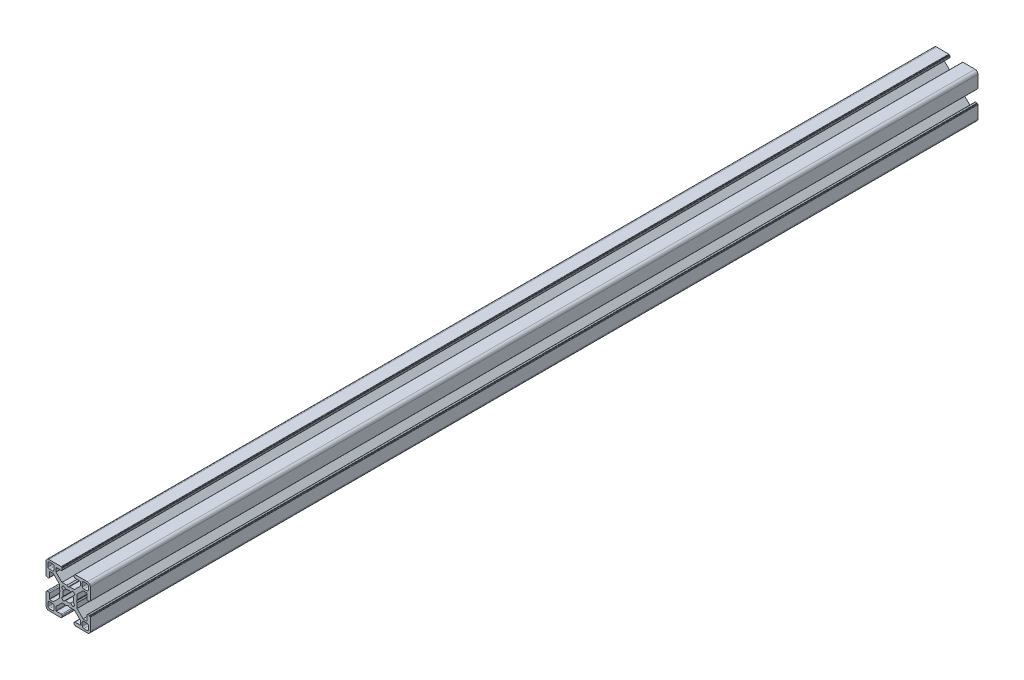
from build123d import *

# Parameters (mm, degrees)
BOSS_EXTRUDE1_DEPTH = 600


with BuildPart() as part:
    # Sketch1 → Boss-Extrude1 (new body)
    with BuildSketch(Plane.XY.offset(25)):
        with BuildLine():
            Line((-4.05, 13.399999434), (-4.05, 14.299999626))
            ThreePointArc((-4.05, 14.299999626), (-4.108578753, 14.441421247), (-4.250000374, 14.5))
            Line((-4.250000374, 14.5), (-4.350000144, 14.5))
            ThreePointArc((-4.350000144, 14.5), (-4.49142109, 14.558578474), (-4.549999564, 14.69999942))
            Line((-4.549999564, 14.69999942), (-4.549999564, 14.799999619))
            ThreePointArc((-4.549999564, 14.799999619), (-4.60857832, 14.941421245), (-4.749999945, 15))
            Line((-4.749999945, 15), (-13.000000346, 15))
            ThreePointArc((-13.000000346, 15), (-14.414213664, 14.414213664), (-15, 13.000000346))
            Line((-15, 13.000000346), (-15, 4.749999521))
            ThreePointArc((-15, 4.749999521), (-14.941421273, 4.608577964), (-14.799999716, 4.549999237))
            Line((-14.799999716, 4.549999237), (-14.700000611, 4.549999237))
            ThreePointArc((-14.700000611, 4.549999237), (-14.558579054, 4.49142051), (-14.500000327, 4.349998953))
            Line((-14.500000327, 4.349998953), (-14.500000327, 4.249999521))
            ThreePointArc((-14.500000327, 4.249999521), (-14.4414216, 4.108577964), (-14.300000043, 4.049999237))
            Line((-14.300000043, 4.049999237), (-13.39999994, 4.049999237))
            ThreePointArc((-13.39999994, 4.049999237), (-12.975735606, 4.225735278), (-12.799999564, 4.649999613))
            Line((-12.799999564, 4.649999613), (-12.799999564, 8.049999716))
            ThreePointArc((-12.799999564, 8.049999716), (-12.741420837, 8.191421273), (-12.59999928, 8.25))
            Line((-12.59999928, 8.25), (-10.049999564, 8.25))
            Line((-10.049999564, 8.25), (-6.00446543, 4.204465866))
            Line((-6.00446543, 4.204465866), (-6.00446543, 0.899999619))
            Line((-6.00446543, 0.899999619), (-5.484852164, 0))
            Line((-5.484852164, 0), (-6.00446543, -0.899999619))
            Line((-6.00446543, -0.899999619), (-6.00446543, -4.204465866))
            Line((-6.00446543, -4.204465866), (-10.049999564, -8.25))
            Line((-10.049999564, -8.25), (-12.59999928, -8.25))
            ThreePointArc((-12.59999928, -8.25), (-12.741420837, -8.191421273), (-12.799999564, -8.049999716))
            Line((-12.799999564, -8.049999716), (-12.799999564, -4.649999613))
            ThreePointArc((-12.799999564, -4.649999613), (-12.975735606, -4.225735278), (-13.39999994, -4.049999237))
            Line((-13.39999994, -4.049999237), (-14.300000043, -4.049999237))
            ThreePointArc((-14.300000043, -4.049999237), (-14.4414216, -4.108577964), (-14.500000327, -4.249999521))
            Line((-14.500000327, -4.249999521), (-14.500000327, -4.349998953))
            ThreePointArc((-14.500000327, -4.349998953), (-14.558579054, -4.49142051), (-14.700000611, -4.549999237))
            Line((-14.700000611, -4.549999237), (-14.799999716, -4.549999237))
            ThreePointArc((-14.799999716, -4.549999237), (-14.941421273, -4.608577964), (-15, -4.749999521))
            Line((-15, -4.749999521), (-15, -13.000000346))
            ThreePointArc((-15, -13.000000346), (-14.414213664, -14.414213664), (-13.000000346, -15))
            Line((-13.000000346, -15), (-4.749999945, -15))
            ThreePointArc((-4.749999945, -15), (-4.60857832, -14.941421245), (-4.549999564, -14.799999619))
            Line((-4.549999564, -14.799999619), (-4.549999564, -14.69999942))
            ThreePointArc((-4.549999564, -14.69999942), (-4.49142109, -14.558578474), (-4.350000144, -14.5))
            Line((-4.350000144, -14.5), (-4.250000374, -14.5))
            ThreePointArc((-4.250000374, -14.5), (-4.108578753, -14.441421247), (-4.05, -14.299999626))
            Line((-4.05, -14.299999626), (-4.05, -13.399999434))
            ThreePointArc((-4.05, -13.399999434), (-4.225735989, -12.975735226), (-4.650000197, -12.799999237))
            Line((-4.650000197, -12.799999237), (-8.049999924, -12.799999237))
            ThreePointArc((-8.049999924, -12.799999237), (-8.191421565, -12.741420475), (-8.250000327, -12.599998834))
            Line((-8.250000327, -12.599998834), (-8.250000327, -10.049999237))
            Line((-8.250000327, -10.049999237), (-4.204466193, -6))
            Line((-4.204466193, -6), (-0.899999946, -6))
            Line((-0.899999946, -6), (0, -5.484851837))
            Line((0, -5.484851837), (0.899999946, -6))
            Line((0.899999946, -6), (4.204466193, -6))
            Line((4.204466193, -6), (8.250000327, -10.049999237))
            Line((8.250000327, -10.049999237), (8.250000327, -12.599998834))
            ThreePointArc((8.250000327, -12.599998834), (8.191421565, -12.741420475), (8.049999924, -12.799999237))
            Line((8.049999924, -12.799999237), (4.650000197, -12.799999237))
            ThreePointArc((4.650000197, -12.799999237), (4.225735989, -12.975735226), (4.05, -13.399999434))
            Line((4.05, -13.399999434), (4.05, -14.299999626))
            ThreePointArc((4.05, -14.299999626), (4.108578753, -14.441421247), (4.250000374, -14.5))
            Line((4.250000374, -14.5), (4.350000144, -14.5))
            ThreePointArc((4.350000144, -14.5), (4.49142109, -14.558578474), (4.549999564, -14.69999942))
            Line((4.549999564, -14.69999942), (4.549999564, -14.799999619))
            ThreePointArc((4.549999564, -14.799999619), (4.60857832, -14.941421245), (4.749999945, -15))
            Line((4.749999945, -15), (13.000000346, -15))
            ThreePointArc((13.000000346, -15), (14.414213664, -14.414213664), (15, -13.000000346))
            Line((15, -13.000000346), (15, -4.749999521))
            ThreePointArc((15, -4.749999521), (14.941421273, -4.608577964), (14.799999716, -4.549999237))
            Line((14.799999716, -4.549999237), (14.700000611, -4.549999237))
            ThreePointArc((14.700000611, -4.549999237), (14.558579054, -4.49142051), (14.500000327, -4.349998953))
            Line((14.500000327, -4.349998953), (14.500000327, -4.249999521))
            ThreePointArc((14.500000327, -4.249999521), (14.4414216, -4.108577964), (14.300000043, -4.049999237))
            Line((14.300000043, -4.049999237), (13.39999994, -4.049999237))
            ThreePointArc((13.39999994, -4.049999237), (12.975735606, -4.225735278), (12.799999564, -4.649999613))
            Line((12.799999564, -4.649999613), (12.799999564, -8.049999716))
            ThreePointArc((12.799999564, -8.049999716), (12.741420837, -8.191421273), (12.59999928, -8.25))
            Line((12.59999928, -8.25), (10.049999564, -8.25))
            Line((10.049999564, -8.25), (6.00446543, -4.204465866))
            Line((6.00446543, -4.204465866), (6.00446543, -0.899999619))
            Line((6.00446543, -0.899999619), (5.484852164, 0))
            Line((5.484852164, 0), (6.00446543, 0.899999619))
            Line((6.00446543, 0.899999619), (6.00446543, 4.204465866))
            Line((6.00446543, 4.204465866), (10.049999564, 8.25))
            Line((10.049999564, 8.25), (12.59999928, 8.25))
            ThreePointArc((12.59999928, 8.25), (12.741420837, 8.191421273), (12.799999564, 8.049999716))
            Line((12.799999564, 8.049999716), (12.799999564, 4.649999613))
            ThreePointArc((12.799999564, 4.649999613), (12.975735606, 4.225735278), (13.39999994, 4.049999237))
            Line((13.39999994, 4.049999237), (14.300000043, 4.049999237))
            ThreePointArc((14.300000043, 4.049999237), (14.4414216, 4.108577964), (14.500000327, 4.249999521))
            Line((14.500000327, 4.249999521), (14.500000327, 4.349998953))
            ThreePointArc((14.500000327, 4.349998953), (14.558579054, 4.49142051), (14.700000611, 4.549999237))
            Line((14.700000611, 4.549999237), (14.799999716, 4.549999237))
            ThreePointArc((14.799999716, 4.549999237), (14.941421273, 4.608577964), (15, 4.749999521))
            Line((15, 4.749999521), (15, 13.000000346))
            ThreePointArc((15, 13.000000346), (14.414213664, 14.414213664), (13.000000346, 15))
            Line((13.000000346, 15), (4.749999945, 15))
            ThreePointArc((4.749999945, 15), (4.60857832, 14.941421245), (4.549999564, 14.799999619))
            Line((4.549999564, 14.799999619), (4.549999564, 14.69999942))
            ThreePointArc((4.549999564, 14.69999942), (4.49142109, 14.558578474), (4.350000144, 14.5))
            Line((4.350000144, 14.5), (4.250000374, 14.5))
            ThreePointArc((4.250000374, 14.5), (4.108578753, 14.441421247), (4.05, 14.299999626))
            Line((4.05, 14.299999626), (4.05, 13.399999434))
            ThreePointArc((4.05, 13.399999434), (4.225735989, 12.975735226), (4.650000197, 12.799999237))
            Line((4.650000197, 12.799999237), (8.049999924, 12.799999237))
            ThreePointArc((8.049999924, 12.799999237), (8.191421565, 12.741420475), (8.250000327, 12.599998834))
            Line((8.250000327, 12.599998834), (8.250000327, 10.049999237))
            Line((8.250000327, 10.049999237), (4.204466193, 6))
            Line((4.204466193, 6), (0.899999946, 6))
            Line((0.899999946, 6), (0, 5.484851837))
            Line((0, 5.484851837), (-0.899999946, 6))
            Line((-0.899999946, 6), (-4.204466193, 6))
            Line((-4.204466193, 6), (-8.250000327, 10.049999237))
            Line((-8.250000327, 10.049999237), (-8.250000327, 12.599998834))
            ThreePointArc((-8.250000327, 12.599998834), (-8.191421565, 12.741420475), (-8.049999924, 12.799999237))
            Line((-8.049999924, 12.799999237), (-4.650000197, 12.799999237))
            ThreePointArc((-4.650000197, 12.799999237), (-4.225735989, 12.975735226), (-4.05, 13.399999434))
        make_face()
        with BuildLine():
            Line((-12.7000011, 13.700000398), (-10.500000318, 13.700000398))
            ThreePointArc((-10.500000318, 13.700000398), (-9.792893543, 13.407107182), (-9.500000327, 12.700000408))
            Line((-9.500000327, 12.700000408), (-9.500000327, 10.499999626))
            ThreePointArc((-9.500000327, 10.499999626), (-9.792893543, 9.792892851), (-10.500000318, 9.499999635))
            Line((-10.500000318, 9.499999635), (-12.7000011, 9.499999635))
            ThreePointArc((-12.7000011, 9.499999635), (-13.407107874, 9.792892851), (-13.70000109, 10.499999626))
            Line((-13.70000109, 10.499999626), (-13.70000109, 12.700000408))
            ThreePointArc((-13.70000109, 12.700000408), (-13.407107874, 13.407107182), (-12.7000011, 13.700000398))
        make_face(mode=Mode.SUBTRACT)
        with BuildLine():
            Line((-10.500000318, -13.700000398), (-12.7000011, -13.700000398))
            ThreePointArc((-12.7000011, -13.700000398), (-13.407107874, -13.407107182), (-13.70000109, -12.700000408))
            Line((-13.70000109, -12.700000408), (-13.70000109, -10.499999626))
            ThreePointArc((-13.70000109, -10.499999626), (-13.407107874, -9.792892851), (-12.7000011, -9.499999635))
            Line((-12.7000011, -9.499999635), (-10.500000318, -9.499999635))
            ThreePointArc((-10.500000318, -9.499999635), (-9.792893543, -9.792892851), (-9.500000327, -10.499999626))
            Line((-9.500000327, -10.499999626), (-9.500000327, -12.700000408))
            ThreePointArc((-9.500000327, -12.700000408), (-9.792893543, -13.407107182), (-10.500000318, -13.700000398))
        make_face(mode=Mode.SUBTRACT)
        with BuildLine():
            Line((10.500000318, 13.700000398), (12.7000011, 13.700000398))
            ThreePointArc((12.7000011, 13.700000398), (13.407107874, 13.407107182), (13.70000109, 12.700000408))
            Line((13.70000109, 12.700000408), (13.70000109, 10.499999626))
            ThreePointArc((13.70000109, 10.499999626), (13.407107874, 9.792892851), (12.7000011, 9.499999635))
            Line((12.7000011, 9.499999635), (10.500000318, 9.499999635))
            ThreePointArc((10.500000318, 9.499999635), (9.792893543, 9.792892851), (9.500000327, 10.499999626))
            Line((9.500000327, 10.499999626), (9.500000327, 12.700000408))
            ThreePointArc((9.500000327, 12.700000408), (9.792893543, 13.407107182), (10.500000318, 13.700000398))
        make_face(mode=Mode.SUBTRACT)
        with BuildLine():
            Line((13.70000109, -10.499999626), (13.70000109, -12.700000408))
            ThreePointArc((13.70000109, -12.700000408), (13.407107874, -13.407107182), (12.7000011, -13.700000398))
            Line((12.7000011, -13.700000398), (10.500000318, -13.700000398))
            ThreePointArc((10.500000318, -13.700000398), (9.792893543, -13.407107182), (9.500000327, -12.700000408))
            Line((9.500000327, -12.700000408), (9.500000327, -10.499999626))
            ThreePointArc((9.500000327, -10.499999626), (9.792893543, -9.792892851), (10.500000318, -9.499999635))
            Line((10.500000318, -9.499999635), (12.7000011, -9.499999635))
            ThreePointArc((12.7000011, -9.499999635), (13.407107874, -9.792892851), (13.70000109, -10.499999626))
        make_face(mode=Mode.SUBTRACT)
        with BuildLine():
            Line((-3.135929412, 4.518400903), (-1.600129524, 3.280561767))
            ThreePointArc((-1.600129524, 3.280561767), (0, 3.65), (1.600129524, 3.280561767))
            Line((1.600129524, 3.280561767), (3.135929412, 4.518400903))
            ThreePointArc((3.135929412, 4.518400903), (3.881002259, 3.897155561), (4.505336892, 3.154669473))
            Line((4.505336892, 3.154669473), (3.280561732, 1.600129597))
            ThreePointArc((3.280561732, 1.600129597), (3.65, 0), (3.280561732, -1.600129597))
            Line((3.280561732, -1.600129597), (4.505336892, -3.154669473))
            ThreePointArc((4.505336892, -3.154669473), (3.881002259, -3.897155561), (3.135929412, -4.518400903))
            Line((3.135929412, -4.518400903), (1.600129524, -3.280561767))
            ThreePointArc((1.600129524, -3.280561767), (0, -3.65), (-1.600129524, -3.280561767))
            Line((-1.600129524, -3.280561767), (-3.135929412, -4.518400903))
            ThreePointArc((-3.135929412, -4.518400903), (-3.881002259, -3.897155561), (-4.505336892, -3.154669473))
            Line((-4.505336892, -3.154669473), (-3.280561732, -1.600129597))
            ThreePointArc((-3.280561732, -1.600129597), (-3.65, 0), (-3.280561732, 1.600129597))
            Line((-3.280561732, 1.600129597), (-4.505336892, 3.154669473))
            ThreePointArc((-4.505336892, 3.154669473), (-3.881002259, 3.897155561), (-3.135929412, 4.518400903))
        make_face(mode=Mode.SUBTRACT)
    extrude(amount=-BOSS_EXTRUDE1_DEPTH)


solid = part.part
